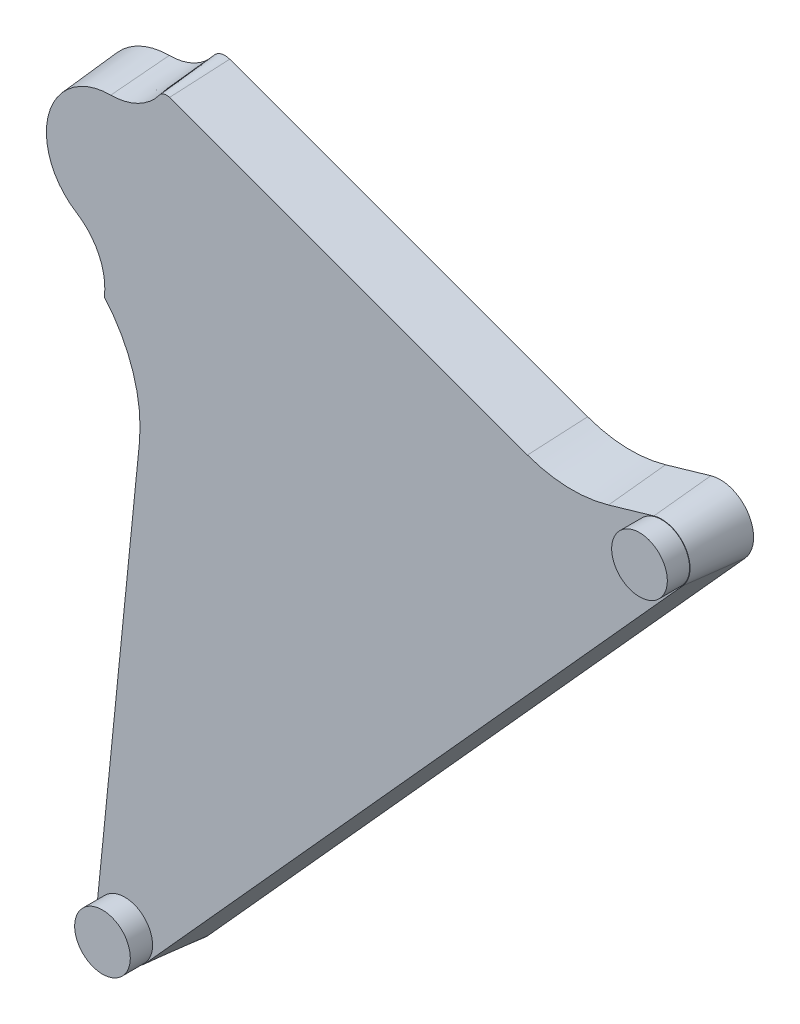
from build123d import *

# Parameters (mm, degrees)
EXTRUDE_1_DEPTH = 21
EXTRUDE_1_TAPER = 5
SKETCH_2_R      = 10
EXTRUDE_2_DEPTH = 8


with BuildPart() as part:
    # Эскиз1 → Бобышка-Вытянуть1 (new body)
    with BuildSketch(Plane.XY):
        with BuildLine():
            ThreePointArc((206.902825712, -28.037707575), (208.16042902, -13.627270923), (194.643197369, -8.47686326))
            Line((194.643197369, -8.47686326), (178.352602864, -13.211762774))
            ThreePointArc((178.352602864, -13.211762774), (164.281318134, -14.974601832), (150.3601632, -12.270882024))
            Line((150.3601632, -12.270882024), (21.714759937, 34.696764669))
            ThreePointArc((21.714759937, 34.696764669), (18.576858011, 34.793189635), (16, 33))
            ThreePointArc((16, 33), (8.94427191, 27.11145618), (0, 25))
            ThreePointArc((0, 25), (-24.017605322, 6.939354046), (-13.333333333, -21.147629234))
            ThreePointArc((-13.333333333, -21.147629234), (-5.735545873, -29.916516988), (-4.284649798, -41.428018512))
            ThreePointArc((-4.284649798, -41.428018512), (6.155658081, -59.36704661), (8.411759167, -80))
            Line((8.411759167, -80), (-6.939849245, -232.746575098))
            ThreePointArc((-6.939849245, -232.746575098), (0.139115456, -244.91798346), (13.910401615, -241.984282673))
            Line((13.910401615, -241.984282673), (206.902825712, -28.037707575))
        make_face()
    extrude(amount=EXTRUDE_1_DEPTH, taper=EXTRUDE_1_TAPER)

    # Эскиз2 → Бобышка-Вытянуть2 (add)
    with BuildSketch(Plane.XY.offset(21)):
        with Locations((5, -233.946575098)):
            Circle(SKETCH_2_R)
        with Locations((197.992424097, -20)):
            Circle(SKETCH_2_R)
    extrude(amount=EXTRUDE_2_DEPTH)


solid = part.part
